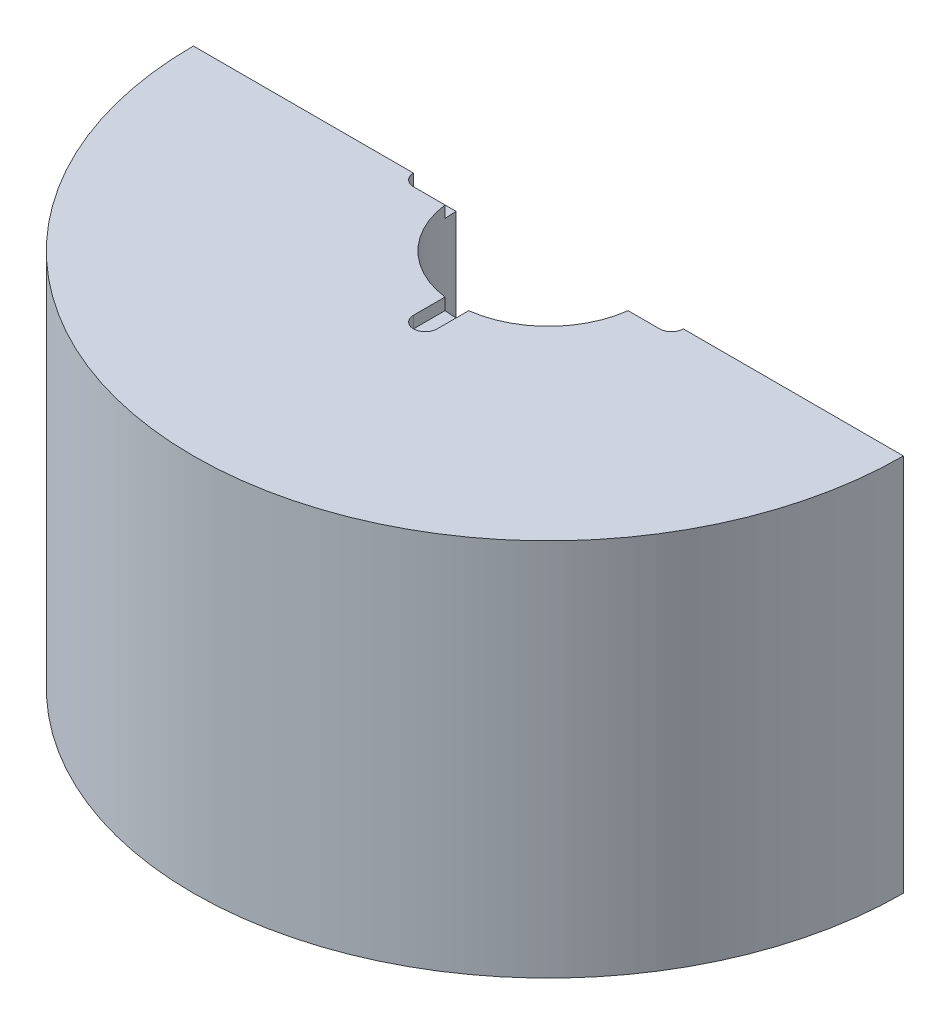
from build123d import *

# Parameters (mm, degrees)
BOSS_EXTRUDE1_DEPTH = 160
CUT_EXTRUDE1_START  = -5
CUT_EXTRUDE1_DEPTH  = 5
CUT_EXTRUDE2_START  = -160
SKETCH2_3_R         = 5
SKETCH2_3_W         = 16.92618617
SKETCH2_3_H         = 10
SKETCH2_3_W_2       = 10
SKETCH2_3_H_2       = 16.92618617
CUT_EXTRUDE2_DEPTH  = 5


with BuildPart() as part:
    # Sketch1 → Boss-Extrude1 (new body)
    with BuildSketch(Plane(origin=(0, 0, 0), x_dir=(1, 0, 0), z_dir=(0, 1, 0))):
        with BuildLine():
            Line((150, 0), (39, 0))
            ThreePointArc((39, 0), (0, -39), (-39, 0))
            Line((-39, 0), (-150, 0))
            ThreePointArc((-150, 0), (0, -150), (150, 0))
        make_face()
    extrude(amount=BOSS_EXTRUDE1_DEPTH)

    # Sketch2 → Cut-Extrude1 (cut)
    with BuildSketch(Plane(origin=(0, 160, 0), x_dir=(1, 0, 0), z_dir=(0, 1, 0)).offset(CUT_EXTRUDE1_START)):
        with BuildLine():
            Line((5, -35.07381383), (-5, -35.07381383))
            Line((-5, -35.07381383), (-5, -52))
            ThreePointArc((-5, -52), (0, -57), (5, -52))
            Line((5, -52), (5, -35.07381383))
        make_face()
        with BuildLine():
            Line((-52, -5), (-38.678159212, -5))
            ThreePointArc((-38.678159212, -5), (-39, 0), (-38.678159212, 5))
            Line((-38.678159212, 5), (-52, 5))
            ThreePointArc((-52, 5), (-57, 0), (-52, -5))
        make_face()
        with BuildLine():
            Line((38.678159212, -5), (52, -5))
            ThreePointArc((52, -5), (57, 0), (52, 5))
            Line((52, 5), (38.678159212, 5))
            ThreePointArc((38.678159212, 5), (39, 0), (38.678159212, -5))
        make_face()
    extrude(amount=CUT_EXTRUDE1_DEPTH, mode=Mode.SUBTRACT)

    # Sketch2<3> → Cut-Extrude2 (cut)
    with BuildSketch(Plane(origin=(0, 160, 0), x_dir=(1, 0, 0), z_dir=(0, 1, 0)).offset(CUT_EXTRUDE2_START)):
        with Locations((0, -52)):
            Circle(SKETCH2_3_R)
        with Locations((-52, 0)):
            Circle(SKETCH2_3_R)
        with Locations((52, 0)):
            Circle(SKETCH2_3_R)
        with Locations((-43.536906915, 0)):
            Rectangle(SKETCH2_3_W, SKETCH2_3_H)
        with Locations((0, -43.536906915)):
            Rectangle(SKETCH2_3_W_2, SKETCH2_3_H_2)
        with Locations((43.536906915, 0)):
            Rectangle(SKETCH2_3_W, SKETCH2_3_H)
    extrude(amount=CUT_EXTRUDE2_DEPTH, mode=Mode.SUBTRACT)


solid = part.part
